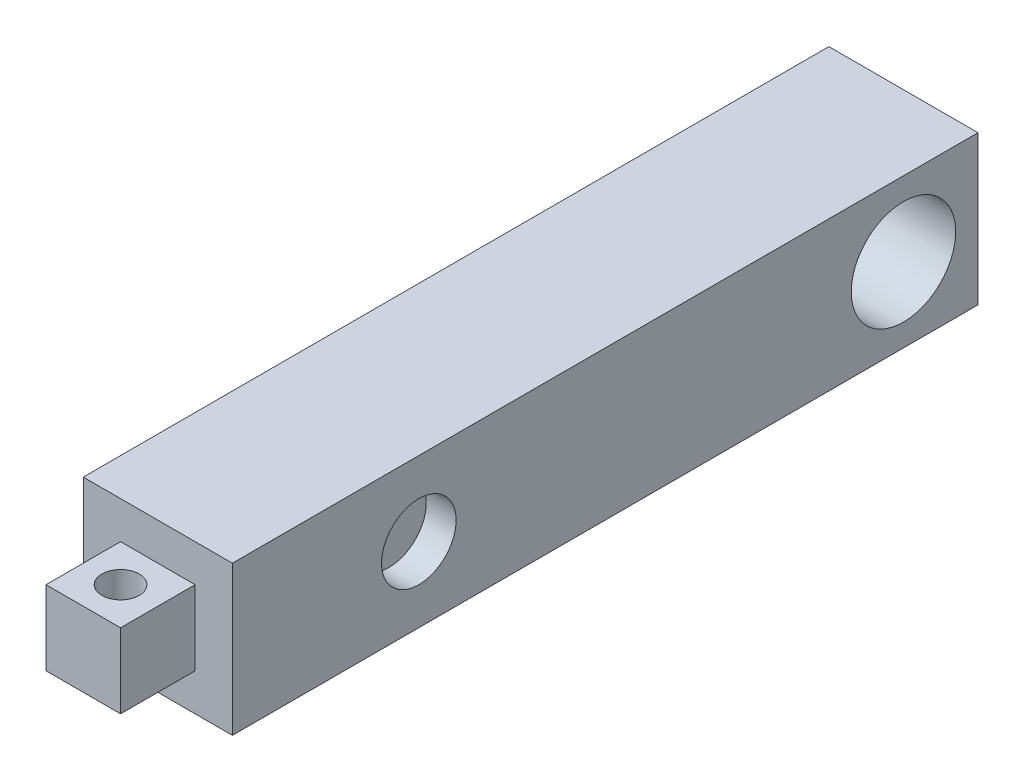
from build123d import *

# Parameters (mm, degrees)
SKETCH1_W               = 200
SKETCH1_H               = 200
BOSS_EXTRUDE1_DEPTH     = 1000
CUT_EXTRUDE1_DEPTH      = 100
CUT_EXTRUDE1_DEPTH_BACK = 300
SKETCH2_R               = 70
SKETCH3_W               = 100
SKETCH3_H               = 100
BOSS_EXTRUDE2_DEPTH     = 100
CUT_EXTRUDE2_DEPTH      = 20
CUT_EXTRUDE2_DEPTH_BACK = 130
SKETCH4_R               = 25
SKETCH7_R               = 50
CUT_EXTRUDE5_DEPTH      = 40
CUT_EXTRUDE6_START      = -40
SKETCH6_R               = 50
CUT_EXTRUDE6_DEPTH      = 40


with BuildPart() as part:
    # Sketch1 → Boss-Extrude1 (new body)
    with BuildSketch(Plane.XY):
        Rectangle(SKETCH1_W, SKETCH1_H)
    extrude(amount=BOSS_EXTRUDE1_DEPTH)

    # Sketch2 → Cut-Extrude1 (cut, two sides: drawn at the far end of the back side and taken through both)
    with BuildSketch(Plane(origin=(100, 0, 0), x_dir=(0, 0, -1), z_dir=(1, 0, 0)).offset(-CUT_EXTRUDE1_DEPTH_BACK)):
        with Locations(Location((-100, 0, 0), (0, 0, 180))):
            Circle(SKETCH2_R)
    extrude(amount=CUT_EXTRUDE1_DEPTH + CUT_EXTRUDE1_DEPTH_BACK, mode=Mode.SUBTRACT)

    # Sketch3 → Boss-Extrude2 (add)
    with BuildSketch(Plane.XY.offset(1000)):
        Rectangle(SKETCH3_W, SKETCH3_H)
    extrude(amount=BOSS_EXTRUDE2_DEPTH)

    # Sketch4 → Cut-Extrude2 (cut, two sides: drawn at the far end of the back side and taken through both)
    with BuildSketch(Plane(origin=(0, -50, 0), x_dir=(-1, 0, 0), z_dir=(0, -1, 0)).offset(-CUT_EXTRUDE2_DEPTH_BACK)):
        with Locations((0, -1050)):
            Circle(SKETCH4_R)
    extrude(amount=CUT_EXTRUDE2_DEPTH + CUT_EXTRUDE2_DEPTH_BACK, mode=Mode.SUBTRACT)

    # Sketch7 → Cut-Extrude5 (cut)
    with BuildSketch(Plane.ZY.offset(100)):
        with Locations((750, 0)):
            Circle(SKETCH7_R)
    extrude(amount=-CUT_EXTRUDE5_DEPTH, mode=Mode.SUBTRACT)

    # Sketch6 → Cut-Extrude6 (cut)
    with BuildSketch(Plane(origin=(100, 0, 0), x_dir=(0, 0, -1), z_dir=(1, 0, 0)).offset(CUT_EXTRUDE6_START)):
        with Locations(Location((-750, 0, 0), (0, 0, 180))):
            Circle(SKETCH6_R)
    extrude(amount=CUT_EXTRUDE6_DEPTH, mode=Mode.SUBTRACT)


solid = part.part
